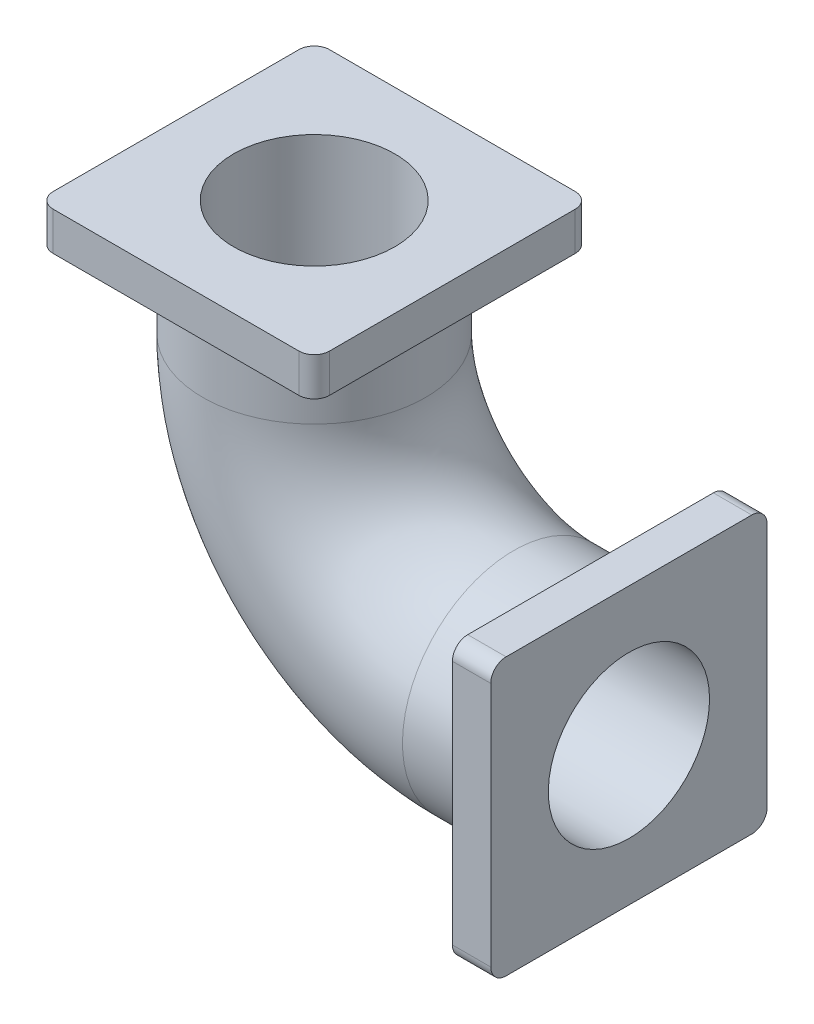
from build123d import *

# Parameters (mm, degrees)
SKETCH3_R           = 145
SKETCH3_R_2         = 105
BOSS_EXTRUDE1_START = -50
SKETCH4_W           = 360
SKETCH4_H           = 360
SKETCH4_R           = 145
BOSS_EXTRUDE1_DEPTH = 50
FILLET1_R           = 20
SKETCH6_W           = 360
SKETCH6_H           = 360
SKETCH6_R           = 145
BOSS_EXTRUDE2_DEPTH = 50
FILLET2_R           = 20
SKETCH7_R           = 30
BOSS_EXTRUDE4_DEPTH = 10


with BuildPart() as part:
    # Sweep-Thin1: sweep along a path in Sketch2
    with BuildLine(Plane.XY) as sweep_thin1_path:
        Line((0, 0), (-150, 0))
        ThreePointArc((-150, 0), (-333.847763109, 76.152236891), (-410, 260))
        Line((-410, 260), (-410, 410))
    # Sketch3 → Sweep-Thin1 (sweep)
    with BuildSketch(Plane(origin=(0, 0, 0), x_dir=(0, 0, -1), z_dir=(1, 0, 0))):
        Circle(SKETCH3_R)
        Circle(SKETCH3_R_2, mode=Mode.SUBTRACT)
    sweep(path=sweep_thin1_path.line)

    # Sketch4 → Boss-Extrude1 (add)
    with BuildSketch(Plane(origin=(0, 0, 0), x_dir=(0, 0, -1), z_dir=(1, 0, 0)).offset(BOSS_EXTRUDE1_START)):
        Rectangle(SKETCH4_W, SKETCH4_H)
        with Locations(Location((0, 0, 0), (0, 0, 270))):
            Circle(SKETCH4_R, mode=Mode.SUBTRACT)
    extrude(amount=BOSS_EXTRUDE1_DEPTH)

    # Fillet1
    fillet1_edges = [part.edges().sort_by_distance(p)[0] for p in [
        (-25, -180, -180),
        (-25, -180, 180),
        (-25, 180, 180),
        (-25, 180, -180),
    ]]
    fillet(fillet1_edges, radius=FILLET1_R)

    # Sketch6 → Boss-Extrude2 (add)
    with BuildSketch(Plane(origin=(0, 410, 0), x_dir=(1, 0, 0), z_dir=(0, 1, 0))):
        with Locations((-410, 0)):
            Rectangle(SKETCH6_W, SKETCH6_H)
        with Locations(Location((-410, 0, 0), (0, 0, 180))):
            Circle(SKETCH6_R, mode=Mode.SUBTRACT)
    extrude(amount=-BOSS_EXTRUDE2_DEPTH)

    # Fillet2
    fillet2_edges = [part.edges().sort_by_distance(p)[0] for p in [
        (-230, 385, 180),
        (-590, 385, 180),
        (-590, 385, -180),
        (-230, 385, -180),
    ]]
    fillet(fillet2_edges, radius=FILLET2_R)

    # Sketch7 → Boss-Extrude4 (add)
    with BuildSketch(Plane(origin=(0, 0, 0), x_dir=(0, 0, -1), z_dir=(1, 0, 0))):
        with Locations((-130, 130)):
            Circle(SKETCH7_R)
    extrude(amount=-BOSS_EXTRUDE4_DEPTH)


solid = part.part
